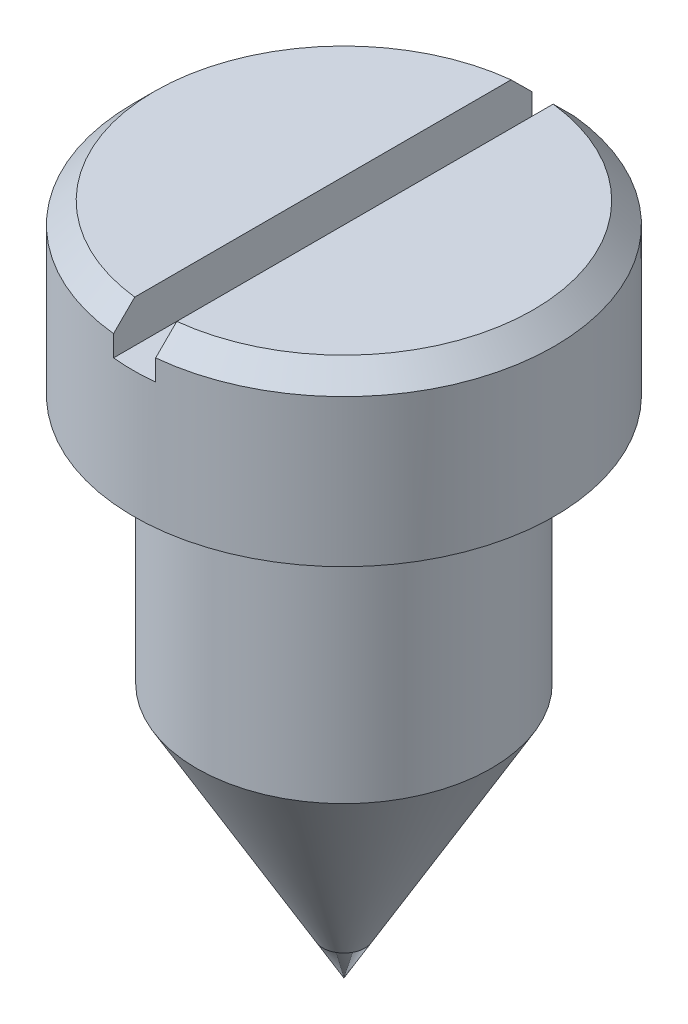
from build123d import *

# Parameters (mm, degrees)
CHAMFER1_SIZE      = 0.5
SKETCH2_W          = 1
SKETCH2_H          = 2
CUT_EXTRUDE1_DEPTH = 5


with BuildPart() as part:
    # Sketch1 → Revolve1 (revolve)
    with BuildSketch(Plane.XY, mode=Mode.PRIVATE) as revolve1_sk:
        Polygon((0, 0), (3.5, 6.062177826), (3.5, 12), (5, 12), (5, 16), (0, 16), align=None)
    revolve(revolve1_sk.sketch.rotate(Axis((0, 16, 0), (0, -1, 0)), 180), axis=Axis((0, 16, 0), (0, -1, 0)))

    # Chamfer1
    chamfer1_edges = [part.edges().sort_by_distance(p)[0] for p in [
        (5, 16, 0),
        (3.5, 12, 0),
    ]]
    chamfer(chamfer1_edges, length=CHAMFER1_SIZE)

    # Sketch2 → Cut-Extrude1 (cut, symmetric)
    with BuildSketch(Plane.XY):
        with Locations((0, 16)):
            Rectangle(SKETCH2_W, SKETCH2_H)
    extrude(amount=CUT_EXTRUDE1_DEPTH, both=True, mode=Mode.SUBTRACT)


solid = part.part
